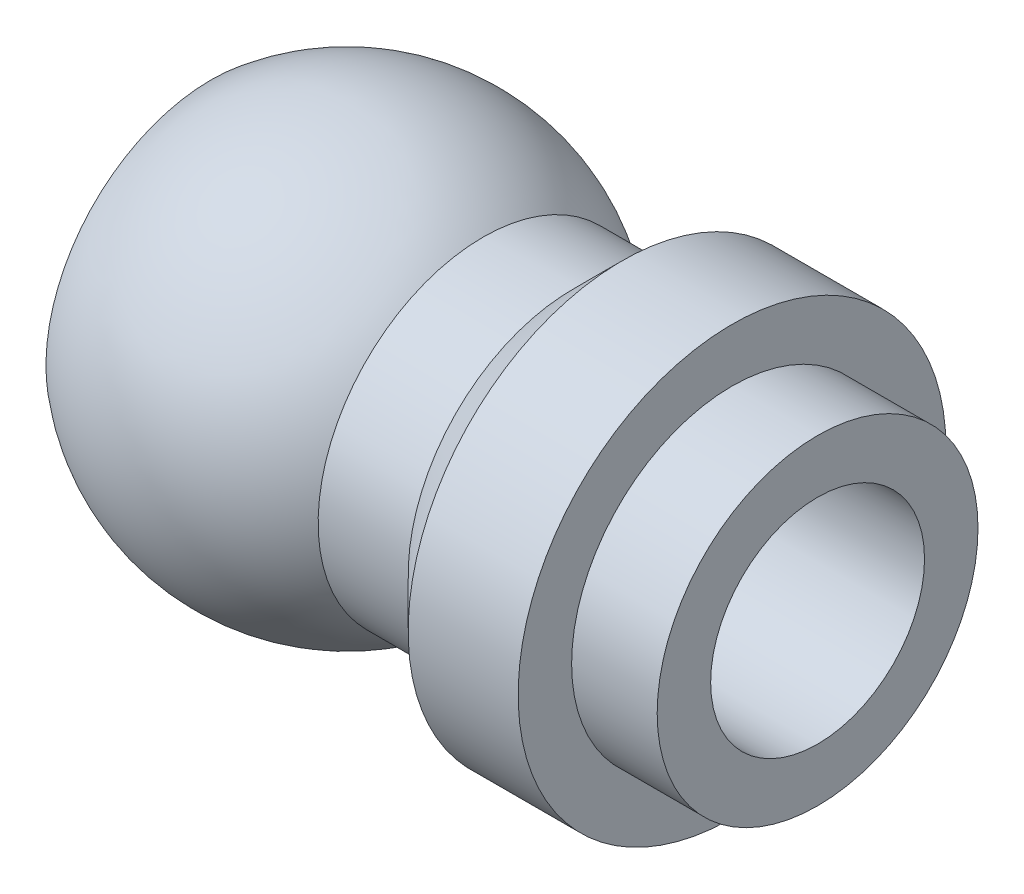
from build123d import *

# Parameters (mm, degrees)
F_1_4_0_25_DIAMETER_HOLE1_D = 6.35


with BuildPart() as part:
    # Sketch1 → Revolve1 (revolve)
    with BuildSketch(Plane.XY):
        with BuildLine():
            Line((0, 0), (0, 4.89857161))
            ThreePointArc((0, 4.89857161), (4.040605918, 6.35), (8.081211835, 4.89857161))
            Line((8.081211835, 4.89857161), (10.753463242, 4.89857161))
            Line((10.753463242, 4.89857161), (12.204891632, 6.35))
            Line((12.204891632, 6.35), (15.470605918, 6.35))
            Line((15.470605918, 6.35), (15.470605918, 4.7625))
            Line((15.470605918, 4.7625), (18.010605918, 4.7625))
            Line((18.010605918, 4.7625), (18.010605918, 0))
            Line((18.010605918, 0), (0, 0))
        make_face()
    revolve(axis=Axis((18.010605918, 0, 0), (-1, 0, 0)))

    # 1/4 (0.25) Diameter Hole1 (through all)
    with Locations(Plane.ZY):
        with Locations((0, 0)):
            Hole(F_1_4_0_25_DIAMETER_HOLE1_D / 2)


solid = part.part
